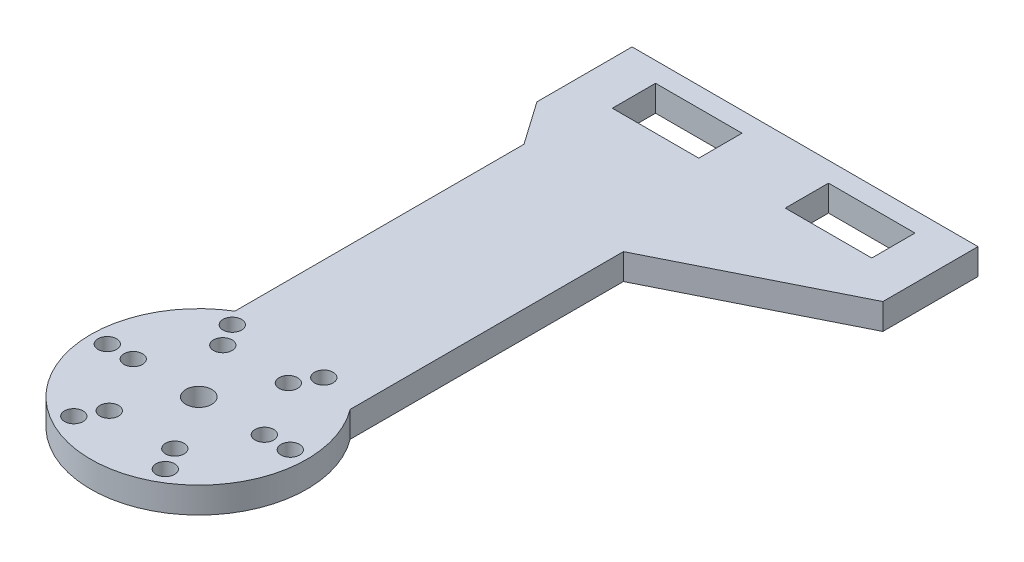
from build123d import *

# Parameters (mm, degrees)
SKETCH_1_R      = 1.075
SKETCH_1_R_2    = 1.5
SKETCH_1_W      = 10
SKETCH_1_H      = 5
EXTRUDE_2_DEPTH = 3


with BuildPart() as part:
    # 草图1 → 凸台-拉伸2 (new body)
    with BuildSketch(Plane(origin=(0, 0, 0), x_dir=(1, 0, 0), z_dir=(0, 1, 0))):
        with BuildLine():
            Line((-6.5, 10.677078252), (-6.5, 44.1))
            Line((-6.5, 44.1), (-10, 49.098518024))
            Line((-10, 49.098518024), (-10, 60.1))
            Line((-10, 60.1), (30, 60.1))
            Line((30, 60.1), (30, 49.1))
            Line((30, 49.1), (10, 39.1))
            Line((10, 39.1), (10, 7.5))
            ThreePointArc((10, 7.5), (-2.363462831, -12.274528237), (-6.5, 10.677078252))
        make_face()
        with Locations(Location((7.58, 0, 0), (0, 0, 270))):
            Circle(SKETCH_1_R, mode=Mode.SUBTRACT)
        with Locations(Location((10.58, 0, 0), (0, 0, 270))):
            Circle(SKETCH_1_R, mode=Mode.SUBTRACT)
        with Locations(Location((3.79, -6.564472561, 0), (0, 0, 270))):
            Circle(SKETCH_1_R, mode=Mode.SUBTRACT)
        with Locations(Location((5.29, -9.162548772, 0), (0, 0, 270))):
            Circle(SKETCH_1_R, mode=Mode.SUBTRACT)
        with Locations(Location((-3.79, -6.564472561, 0), (0, 0, 270))):
            Circle(SKETCH_1_R, mode=Mode.SUBTRACT)
        with Locations(Location((-5.29, -9.162548772, 0), (0, 0, 270))):
            Circle(SKETCH_1_R, mode=Mode.SUBTRACT)
        with Locations(Location((-7.58, 0, 0), (0, 0, 270))):
            Circle(SKETCH_1_R, mode=Mode.SUBTRACT)
        with Locations(Location((-10.58, 0, 0), (0, 0, 270))):
            Circle(SKETCH_1_R, mode=Mode.SUBTRACT)
        with Locations(Location((-3.79, 6.564472561, 0), (0, 0, 270))):
            Circle(SKETCH_1_R, mode=Mode.SUBTRACT)
        with Locations(Location((-5.29, 9.162548772, 0), (0, 0, 270))):
            Circle(SKETCH_1_R, mode=Mode.SUBTRACT)
        with Locations(Location((3.79, 6.564472561, 0), (0, 0, 270))):
            Circle(SKETCH_1_R, mode=Mode.SUBTRACT)
        with Locations(Location((5.29, 9.162548772, 0), (0, 0, 270))):
            Circle(SKETCH_1_R, mode=Mode.SUBTRACT)
        with Locations(Location((0, 0, 0), (0, 0, 270))):
            Circle(SKETCH_1_R_2, mode=Mode.SUBTRACT)
        with Locations((0, 55.314192659)):
            Rectangle(SKETCH_1_W, SKETCH_1_H, mode=Mode.SUBTRACT)
        with Locations((20, 55.314192659)):
            Rectangle(SKETCH_1_W, SKETCH_1_H, mode=Mode.SUBTRACT)
    extrude(amount=EXTRUDE_2_DEPTH)


solid = part.part
